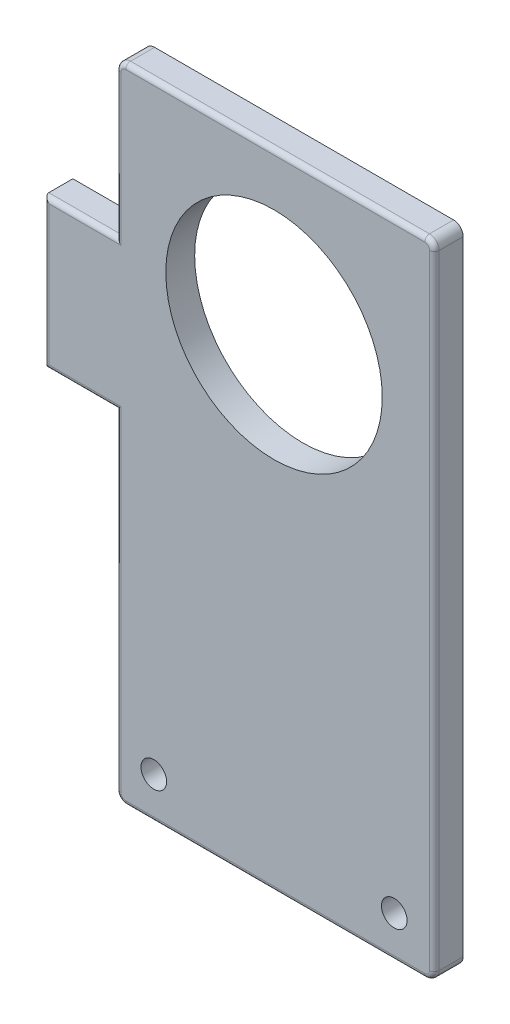
from build123d import *

# Parameters (mm, degrees)
SKETCH_1_R          = 6.75
EXTRUDE_1_DEPTH     = 1.8
SKETCH_2_R          = 0.8
CUT_EXTRUDE_1_DEPTH = 2
SKETCH_3_R          = 1.75
CUT_EXTRUDE_2_DEPTH = 0.5
SKETCH_4_W          = 4.5
SKETCH_4_H          = 9.8
EXTRUDE_2_DEPTH     = 1.8
SKETCH_5_R          = 1.75
EXTRUDE_3_DEPTH     = 1.3
SKETCH_6_R          = 1.75
EXTRUDE_4_DEPTH     = 1.8
EXTRUDE_5_DEPTH     = 1.8
CUT_EXTRUDE_3_DEPTH = 10
FILLET_1_R          = 0.7
CUT_EXTRUDE_4_DEPTH = 10
FILLET_2_R          = 0.3


with BuildPart() as part:
    # 草图1 → 凸台-拉伸1 (new body)
    with BuildSketch(Plane.XY):
        with BuildLine():
            Line((0.7, 0), (19.5, 0))
            ThreePointArc((19.5, 0), (19.994974747, -0.205025253), (20.2, -0.7))
            Line((20.2, -0.7), (20.2, -39.6))
            ThreePointArc((20.2, -39.6), (19.994974747, -40.094974747), (19.5, -40.3))
            Line((19.5, -40.3), (0.7, -40.3))
            ThreePointArc((0.7, -40.3), (0.205025253, -40.094974747), (0, -39.6))
            Line((0, -39.6), (0, -0.7))
            ThreePointArc((0, -0.7), (0.205025253, -0.205025253), (0.7, 0))
        make_face()
        with Locations((10.1, -10.1)):
            Circle(SKETCH_1_R, mode=Mode.SUBTRACT)
    extrude(amount=EXTRUDE_1_DEPTH)

    # 草图2 → 切除-拉伸1 (cut)
    with BuildSketch(Plane.XY.offset(1.8)):
        with Locations((17.6, -2.6)):
            Circle(SKETCH_2_R)
        with Locations((17.6, -37.6)):
            Circle(SKETCH_2_R)
        with Locations((2.6, -37.6)):
            Circle(SKETCH_2_R)
        with Locations((2.6, -2.6)):
            Circle(SKETCH_2_R)
    extrude(amount=-CUT_EXTRUDE_1_DEPTH, mode=Mode.SUBTRACT)

    # 草图3 → 切除-拉伸2 (cut)
    with BuildSketch(Plane(origin=(0, 0, 0), x_dir=(-1, 0, 0), z_dir=(0, 0, -1))):
        with Locations((-17.6, -2.6)):
            Circle(SKETCH_3_R)
        with Locations((-2.6, -2.6)):
            Circle(SKETCH_3_R)
        with Locations((-17.6, -37.6)):
            Circle(SKETCH_3_R)
        with Locations((-2.6, -37.6)):
            Circle(SKETCH_3_R)
    extrude(amount=-CUT_EXTRUDE_2_DEPTH, mode=Mode.SUBTRACT)

    # 草图4 → 凸台-拉伸2 (add)
    with BuildSketch(Plane(origin=(0, 0, 0), x_dir=(-1, 0, 0), z_dir=(0, 0, -1))):
        with Locations((2.25, -14.4)):
            Rectangle(SKETCH_4_W, SKETCH_4_H)
    extrude(amount=-EXTRUDE_2_DEPTH)

    # 草图5 → 凸台-拉伸3 (add)
    with BuildSketch(Plane(origin=(0, 0, 0.5), x_dir=(-1, 0, 0), z_dir=(0, 0, -1))):
        with Locations((-2.6, -2.6)):
            Circle(SKETCH_5_R)
        with Locations((-17.6, -2.6)):
            Circle(SKETCH_5_R)
    extrude(amount=-EXTRUDE_3_DEPTH)

    # 草图6 → 凸台-拉伸4 (add)
    with BuildSketch(Plane(origin=(0, 0, 0), x_dir=(-1, 0, 0), z_dir=(0, 0, -1))):
        with Locations((-17.6, -2.6)):
            Circle(SKETCH_6_R)
        with Locations((-2.6, -2.6)):
            Circle(SKETCH_6_R)
    extrude(amount=-EXTRUDE_4_DEPTH)

    # 草图8 → 凸台-拉伸5 (add)
    with BuildSketch(Plane(origin=(0, 0, 0), x_dir=(-1, 0, 0), z_dir=(0, 0, -1))):
        Polygon((-0.7, 0), (0, 0), (0, -0.7), align=None)
        Polygon((-0.7, -40.3), (0, -40.3), (0, -39.6), align=None)
    extrude(amount=-EXTRUDE_5_DEPTH)

    # 草图9 → 切除-拉伸3 (cut)
    with BuildSketch(Plane(origin=(0, 0, 0), x_dir=(-1, 0, 0), z_dir=(0, 0, -1))):
        Polygon((0, -19.3), (0, -40.3), (-0.15, -40.3), (-0.15, -19.15), (4.35, -19.15), (4.35, -9.65), (-0.15, -9.65), (-0.15, 0), (0, 0), (0, -9.5), (4.5, -9.5), (4.5, -19.3), align=None)
    extrude(amount=-CUT_EXTRUDE_3_DEPTH, mode=Mode.SUBTRACT)

    # 圆角1
    fillet_1_edges = [part.edges().sort_by_distance(p)[0] for p in [
        (0.15, -40.3, 0.9),
        (0.15, 0, 0.9),
    ]]
    fillet(fillet_1_edges, radius=FILLET_1_R)

    # 草图10 → 切除-拉伸4 (cut)
    with BuildSketch(Plane(origin=(0, 0, 0), x_dir=(-1, 0, 0), z_dir=(0, 0, -1))):
        with BuildLine():
            ThreePointArc((-20.2, -39.6), (-19.994974747, -40.094974747), (-19.5, -40.3))
            Line((-19.5, -40.3), (-0.85, -40.3))
            ThreePointArc((-0.85, -40.3), (-0.355025253, -40.094974747), (-0.15, -39.6))
            Line((-0.15, -39.6), (-0.15, -19.15))
            Line((-0.15, -19.15), (4.35, -19.15))
            Line((4.35, -19.15), (4.35, -9.65))
            Line((4.35, -9.65), (-0.15, -9.65))
            Line((-0.15, -9.65), (-0.15, -0.7))
            ThreePointArc((-0.15, -0.7), (-0.355025253, -0.205025253), (-0.85, 0))
            Line((-0.85, 0), (-19.5, 0))
            ThreePointArc((-19.5, 0), (-19.994974747, -0.205025253), (-20.2, -0.7))
            Line((-20.2, -0.7), (-20.2, -39.6))
        make_face()
        with BuildLine():
            ThreePointArc((-20.1, -39.6), (-19.924264069, -40.024264069), (-19.5, -40.2))
            Line((-19.5, -40.2), (-0.85, -40.2))
            ThreePointArc((-0.85, -40.2), (-0.425735931, -40.024264069), (-0.25, -39.6))
            Line((-0.25, -39.6), (-0.25, -19.05))
            Line((-0.25, -19.05), (4.25, -19.05))
            Line((4.25, -19.05), (4.25, -9.75))
            Line((4.25, -9.75), (-0.25, -9.75))
            Line((-0.25, -9.75), (-0.25, -0.7))
            ThreePointArc((-0.25, -0.7), (-0.425735931, -0.275735931), (-0.85, -0.1))
            Line((-0.85, -0.1), (-19.5, -0.1))
            ThreePointArc((-19.5, -0.1), (-19.924264069, -0.275735931), (-20.1, -0.7))
            Line((-20.1, -0.7), (-20.1, -39.6))
        make_face(mode=Mode.SUBTRACT)
    extrude(amount=-CUT_EXTRUDE_4_DEPTH, mode=Mode.SUBTRACT)

    # 圆角2
    fillet_2_edges = [part.edges().sort_by_distance(p)[0] for p in [
        (19.924264069, -40.024264069, 1.8),
        (10.175, -40.2, 1.8),
        (0.425735931, -40.024264069, 1.8),
        (0.25, -29.325, 1.8),
        (-2, -19.05, 1.8),
        (-4.25, -14.4, 1.8),
        (-2, -9.75, 1.8),
        (0.25, -5.225, 1.8),
        (0.425735931, -0.275735931, 1.8),
        (10.175, -0.1, 1.8),
        (19.924264069, -0.275735931, 1.8),
        (20.1, -20.15, 1.8),
    ]]
    fillet(fillet_2_edges, radius=FILLET_2_R)


solid = part.part
